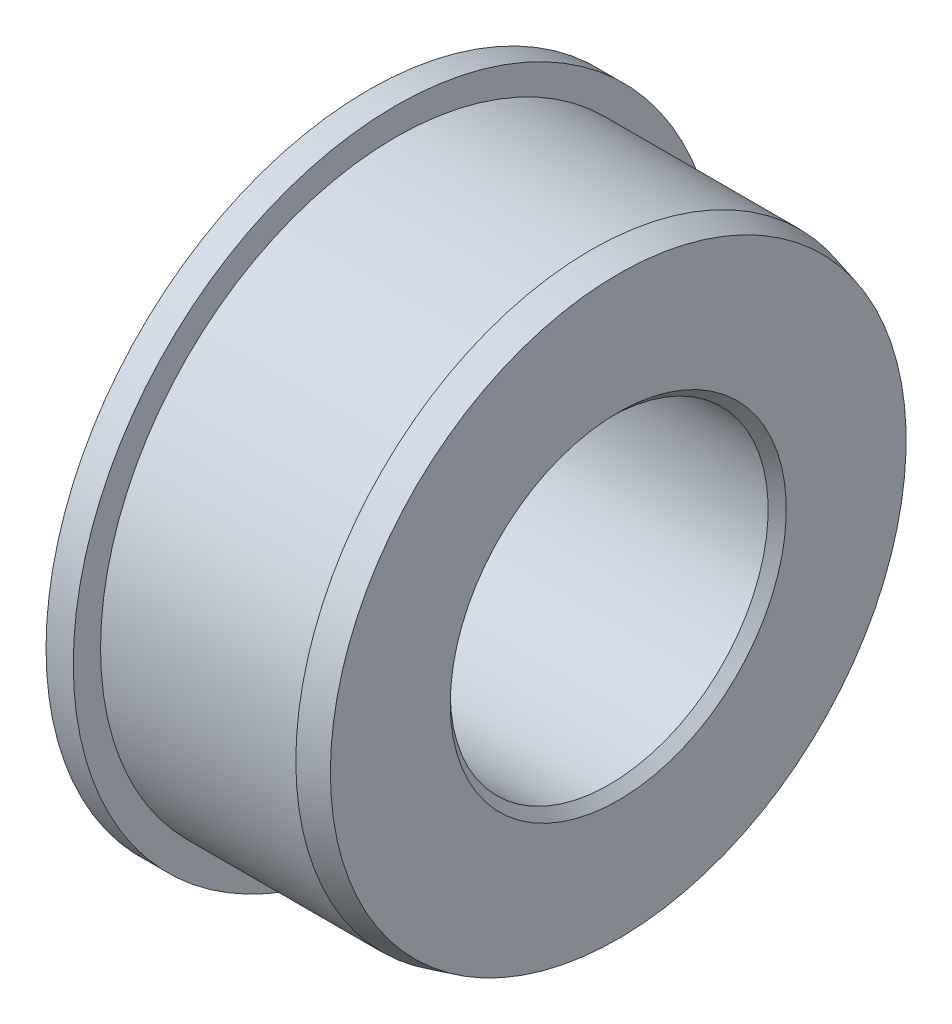
from build123d import *


with BuildPart() as part:
    # Эскиз1 → Повернуть1 (revolve)
    with BuildSketch(Plane.XY, mode=Mode.PRIVATE) as revolve_1_sk:
        Polygon((0, 18.5), (0, 35.5), (3, 35.5), (3, 32.5), (24.5, 32.5), (27.5, 31.696152423), (27.5, 18.5), (26.5, 17.5), (1, 17.5), align=None)
    revolve(revolve_1_sk.sketch.rotate(Axis((0, 0, 0), (1, 0, 0)), 90), axis=Axis((0, 0, 0), (1, 0, 0)))


solid = part.part
